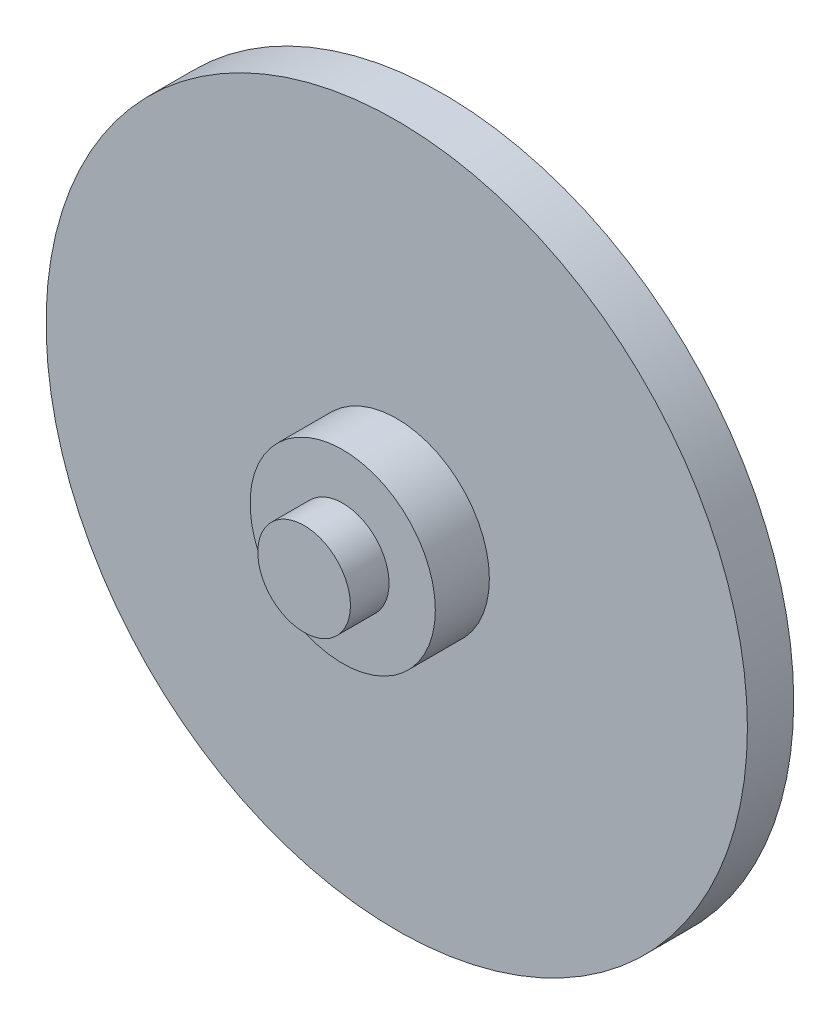
from build123d import *

# Parameters (mm, degrees)
SKETCH2_R           = 45.43
BOSS_EXTRUDE2_DEPTH = 6
SKETCH3_R           = 12
BOSS_EXTRUDE3_DEPTH = 7
SKETCH4_R           = 6
BOSS_EXTRUDE4_DEPTH = 5
SKETCH5_R           = 3
CUT_EXTRUDE1_DEPTH  = 13
SCALE1_SCALE        = 0.15


with BuildPart() as part:
    # Sketch2 → Boss-Extrude2 (new body)
    with BuildSketch(Plane.XY):
        with Locations((-5.265954001, 0)):
            Circle(SKETCH2_R)
    extrude(amount=BOSS_EXTRUDE2_DEPTH)

    # Sketch3 → Boss-Extrude3 (add)
    with BuildSketch(Plane.XY.offset(6)):
        with Locations((-5.265954001, 0)):
            Circle(SKETCH3_R)
    extrude(amount=BOSS_EXTRUDE3_DEPTH)

    # Sketch4 → Boss-Extrude4 (add)
    with BuildSketch(Plane.XY.offset(13)):
        with Locations((-5.265954001, 0)):
            Circle(SKETCH4_R)
    extrude(amount=BOSS_EXTRUDE4_DEPTH)

    # Sketch5 → Cut-Extrude1 (cut)
    with BuildSketch(Plane(origin=(0, 0, 0), x_dir=(-1, 0, 0), z_dir=(0, 0, -1))):
        with Locations((5.265954001, 0)):
            Circle(SKETCH5_R)
    extrude(amount=-CUT_EXTRUDE1_DEPTH, mode=Mode.SUBTRACT)


with BuildPart() as part_1:
    # Scale1: scaled about (-5.265954001, 0, 3.623777836)
    add(part.part.scale(SCALE1_SCALE).moved(Location((-4.476060901, 0, 3.080211161))))


solid = part_1.part
